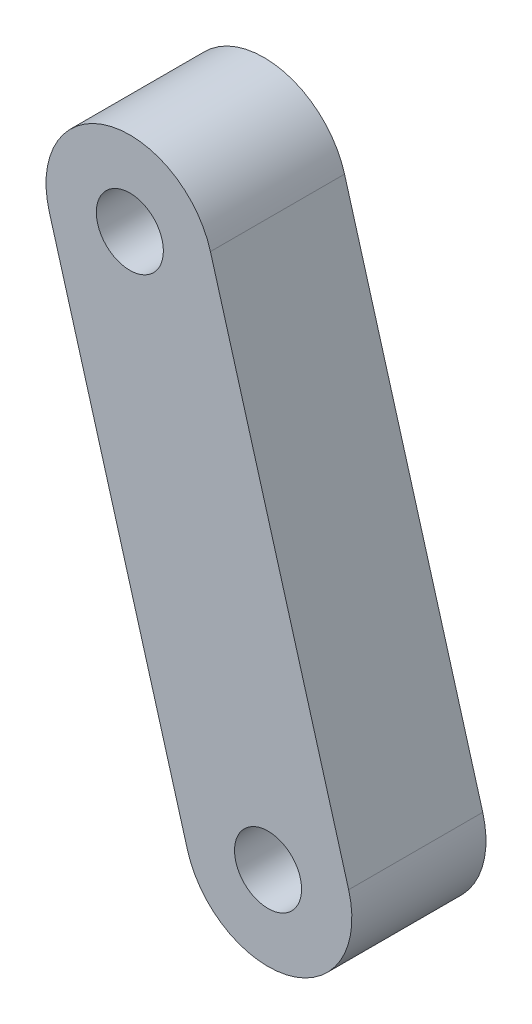
from build123d import *

# Parameters (mm, degrees)
SKETCH_1_R      = 2
EXTRUDE_1_DEPTH = 4


with BuildPart() as part:
    # 草图1 → 凸台-拉伸1 (new, symmetric)
    with BuildSketch(Plane.XY):
        with BuildLine():
            Line((26.540252696, 65.540404046), (34.784553035, 36.695447608))
            ThreePointArc((34.784553035, 36.695447608), (31.351110352, 30.513904812), (25.169567556, 33.947347495))
            Line((25.169567556, 33.947347495), (16.925267217, 62.792303933))
            ThreePointArc((16.925267217, 62.792303933), (20.3587099, 68.97384673), (26.540252696, 65.540404046))
        make_face()
        with Locations((21.732759957, 64.16635399)):
            Circle(SKETCH_1_R, mode=Mode.SUBTRACT)
        with Locations((29.977060295, 35.321397552)):
            Circle(SKETCH_1_R, mode=Mode.SUBTRACT)
    extrude(amount=EXTRUDE_1_DEPTH, both=True)


solid = part.part
